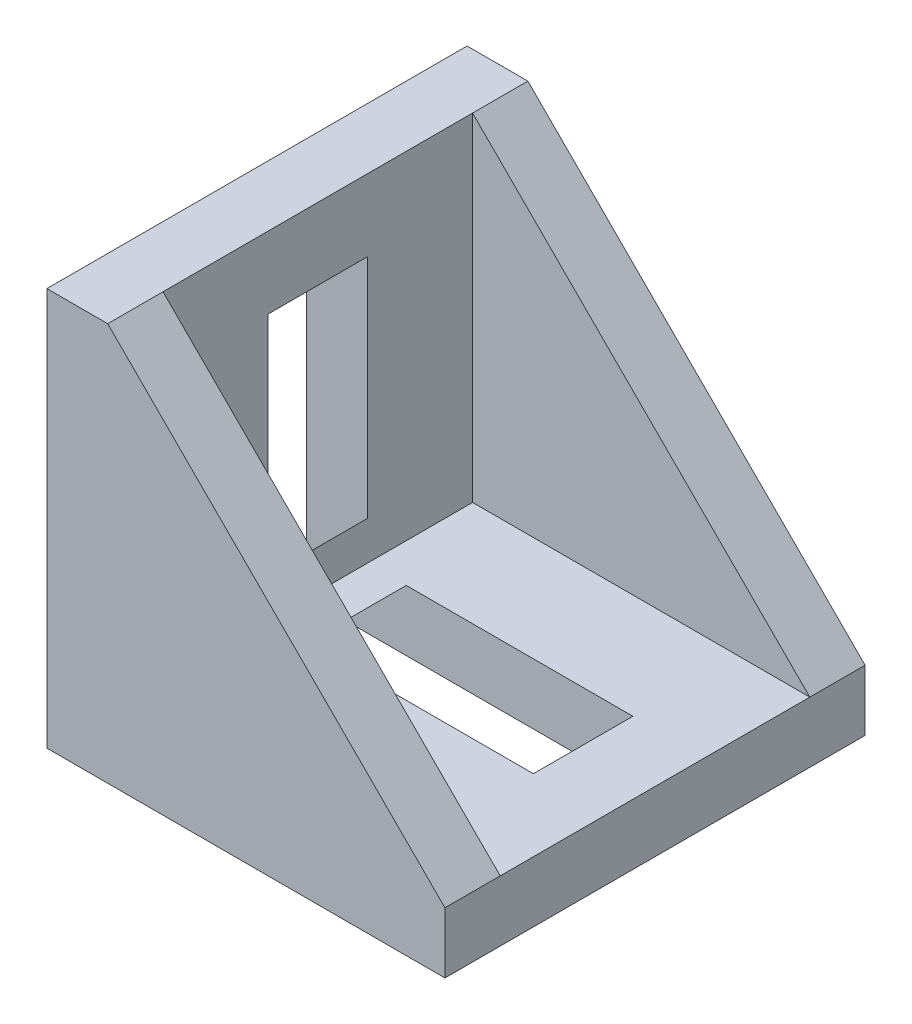
from build123d import *

# Parameters (mm, degrees)
BOSS_EXTRUDE1_DEPTH = 19
CUT_EXTRUDE1_DEPTH  = 14
CUT_EXTRUDE2_DEPTH  = 4.5
BOSS_EXTRUDE2_DEPTH = 4


with BuildPart() as part:
    # Sketch1 → Boss-Extrude1 (new, symmetric)
    with BuildSketch(Plane.XY):
        Polygon((0, 0), (0, 36), (5.5, 36), (36, 5.5), (36, 0), align=None)
    extrude(amount=BOSS_EXTRUDE1_DEPTH, both=True)

    # Sketch2 → Cut-Extrude1 (cut, symmetric)
    with BuildSketch(Plane.XY):
        Polygon((5.5, 36), (5.5, 5.5), (36, 5.5), align=None)
    extrude(amount=CUT_EXTRUDE1_DEPTH, both=True, mode=Mode.SUBTRACT)

    # Sketch3 → Cut-Extrude2 (cut, symmetric)
    with BuildSketch(Plane.XY):
        Polygon((0, 29.5), (5.5, 29.5), (5.5, 9), (0, 3.5), align=None)
        Polygon((9, 5.5), (29.5, 5.5), (29.5, 0), (3.5, 0), align=None)
    extrude(amount=CUT_EXTRUDE2_DEPTH, both=True, mode=Mode.SUBTRACT)

    # Sketch4 → Boss-Extrude2 (add, symmetric)
    with BuildSketch(Plane.XY):
        Polygon((0.714757963, -2.5), (-0.201070953, -1.5696698), (1.234750477, 0), (3.535533906, 0), align=None)
        Polygon((0, 3.535533906), (-2.5, 0.714757963), (-1.5696698, -0.201070953), (0, 1.234750477), align=None)
        Polygon((0, 35.3), (0, 32.999216572), (-1.5696698, 31.563395141), (-2.5, 32.479224057), align=None)
        Polygon((32.999216572, 0), (31.563395141, -1.5696698), (32.479224057, -2.5), (35.3, 0), align=None)
    extrude(amount=BOSS_EXTRUDE2_DEPTH, both=True)


solid = part.part
